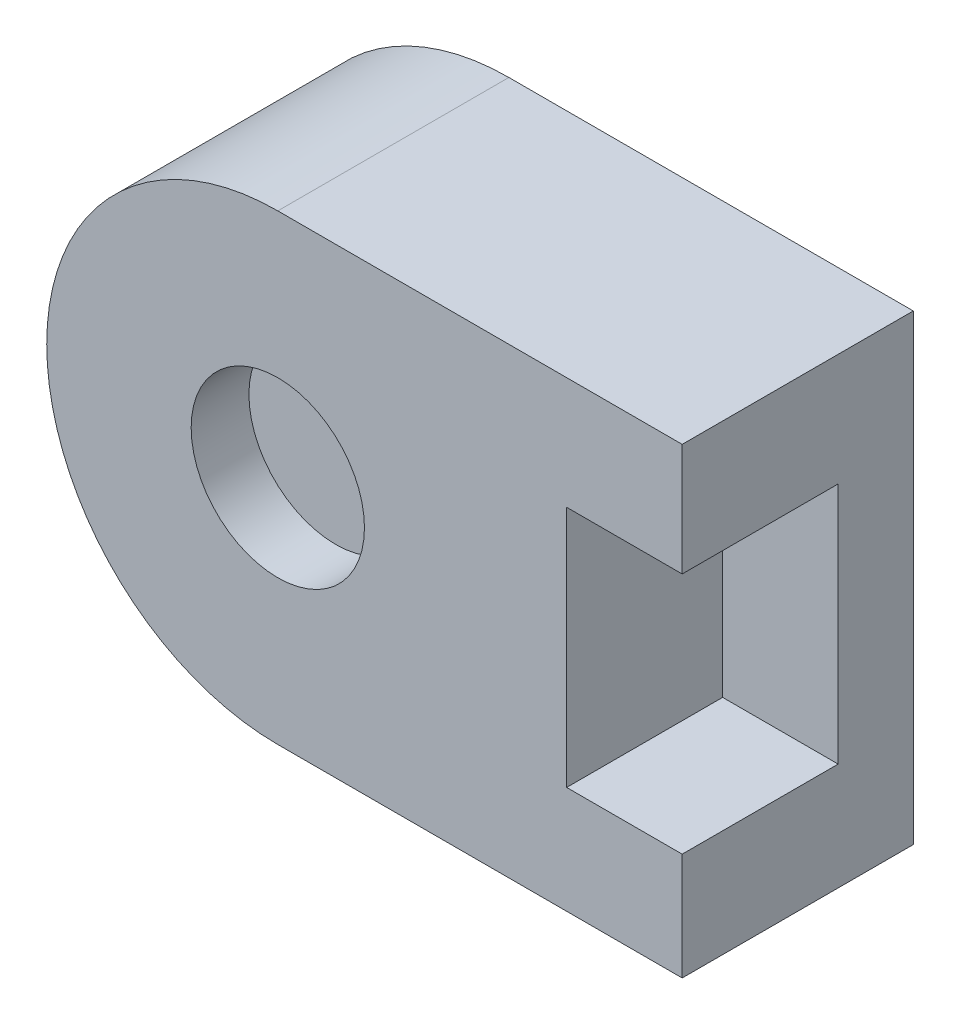
from build123d import *

# Parameters (mm, degrees)
BOSS_EXTRUDE1_DEPTH = 40
SKETCH2_W           = 20
SKETCH2_H           = 42
CUT_EXTRUDE1_DEPTH  = 27
SKETCH3_R           = 15
CUT_EXTRUDE2_DEPTH  = 10


with BuildPart() as part:
    # Sketch1 → Boss-Extrude1 (new body)
    with BuildSketch(Plane.XY):
        with BuildLine():
            Line((0, 40), (70, 40))
            Line((70, 40), (70, -40))
            Line((70, -40), (0, -40))
            ThreePointArc((0, -40), (-40, 0), (0, 40))
        make_face()
    extrude(amount=BOSS_EXTRUDE1_DEPTH)

    # Sketch2 → Cut-Extrude1 (cut)
    with BuildSketch(Plane.XY.offset(40)):
        with Locations((60, -0.432961974)):
            Rectangle(SKETCH2_W, SKETCH2_H)
    extrude(amount=-CUT_EXTRUDE1_DEPTH, mode=Mode.SUBTRACT)

    # Sketch3 → Cut-Extrude2 (cut)
    with BuildSketch(Plane.XY.offset(40)):
        Circle(SKETCH3_R)
    extrude(amount=-CUT_EXTRUDE2_DEPTH, mode=Mode.SUBTRACT)


solid = part.part
